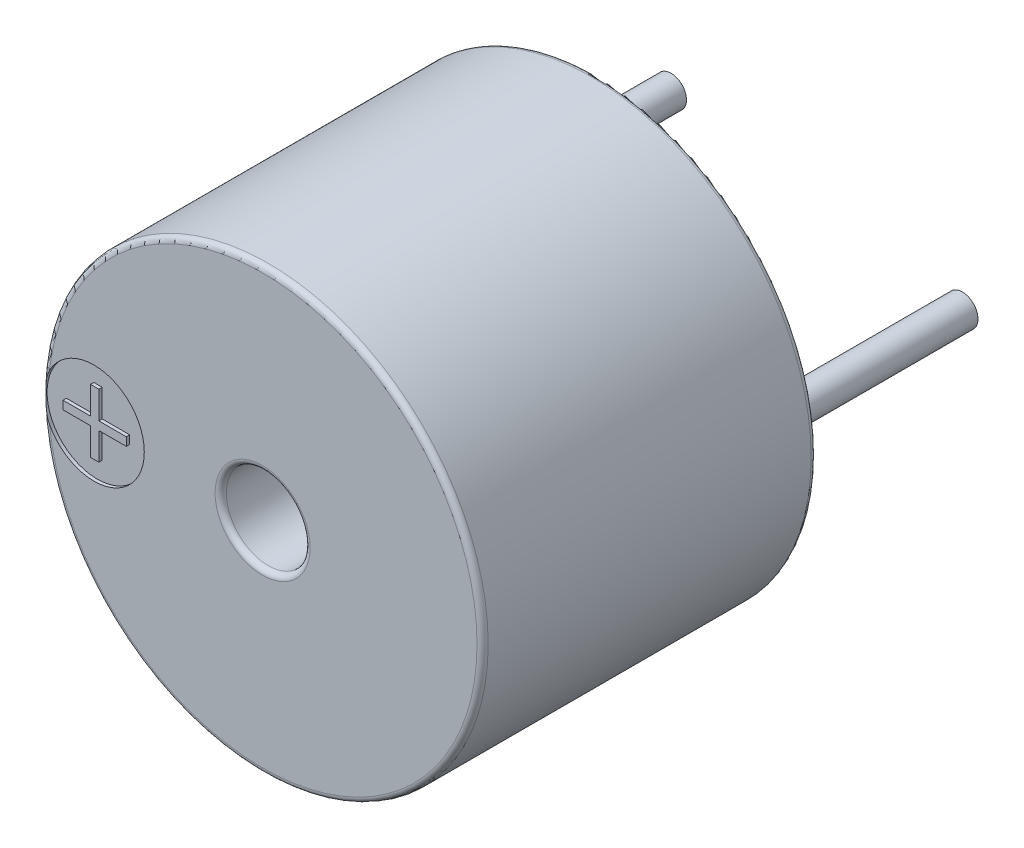
from build123d import *

# Parameters (mm, degrees)
SKETCH2_R           = 5
BOSS_EXTRUDE1_DEPTH = 7.5946
SKETCH3_R           = 0.9525
CUT_EXTRUDE1_DEPTH  = 2.54
FILLET1_R           = 0.127
SKETCH4_R           = 0.35
BOSS_EXTRUDE2_DEPTH = 5.5
SKETCH7_R           = 0.3556
BOSS_EXTRUDE3_DEPTH = 4.5
SKETCH6_R           = 1.143
CUT_EXTRUDE3_DEPTH  = 0.0762


with BuildPart() as part:
    # Sketch2 → Boss-Extrude1 (new body)
    with BuildSketch(Plane.XY):
        Circle(SKETCH2_R)
    extrude(amount=BOSS_EXTRUDE1_DEPTH)

    # Sketch3 → Cut-Extrude1 (cut)
    with BuildSketch(Plane.XY.offset(7.5946)):
        Circle(SKETCH3_R)
    extrude(amount=-CUT_EXTRUDE1_DEPTH, mode=Mode.SUBTRACT)

    # Fillet1
    fillet1_edges = [part.edges().sort_by_distance(p)[0] for p in [
        (-0.9525, 0, 7.5946),
        (-5, 0, 0),
        (-5, 0, 7.5946),
    ]]
    fillet(fillet1_edges, radius=FILLET1_R)

    # Sketch4 → Boss-Extrude2 (add)
    with BuildSketch(Plane(origin=(0, 0, 0), x_dir=(-1, 0, 0), z_dir=(0, 0, -1))):
        with Locations((3.81, 0)):
            Circle(SKETCH4_R)
    extrude(amount=BOSS_EXTRUDE2_DEPTH)

    # Sketch7 → Boss-Extrude3 (add)
    with BuildSketch(Plane(origin=(0, 0, 0), x_dir=(-1, 0, 0), z_dir=(0, 0, -1))):
        with Locations((-3.81, 0)):
            Circle(SKETCH7_R)
    extrude(amount=BOSS_EXTRUDE3_DEPTH)

    # Sketch6 → Cut-Extrude3 (cut)
    with BuildSketch(Plane.XY.offset(7.5946)):
        with Locations((-3.832516077, 0)):
            Circle(SKETCH6_R)
        Polygon((-3.912034188, 0.09834359), (-3.912034188, 0.722488889), (-3.722076923, 0.722488889), (-3.722076923, 0.09834359), (-3.097931624, 0.09834359), (-3.097931624, -0.091613675), (-3.722076923, -0.091613675), (-3.722076923, -0.715758974), (-3.912034188, -0.715758974), (-3.912034188, -0.091613675), (-4.536179487, -0.091613675), (-4.536179487, 0.09834359), align=None, mode=Mode.SUBTRACT)
    extrude(amount=-CUT_EXTRUDE3_DEPTH, mode=Mode.SUBTRACT)


solid = part.part
